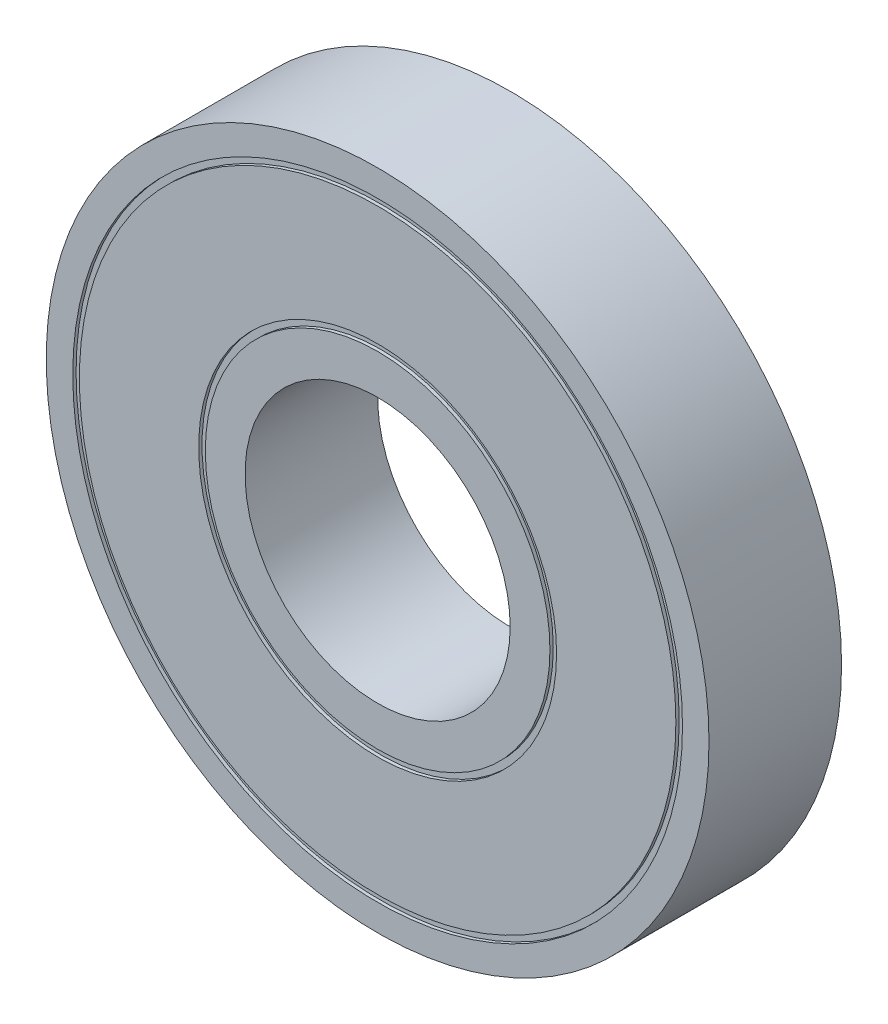
from build123d import *

# Parameters (mm, degrees)
ESBO_O1_R                = 25
ESBO_O1_R_2              = 10
RESSALTO_EXTRUS_O1_DEPTH = 5
ESBO_O2_R                = 23
ESBO_O2_R_2              = 22.5
ESBO_O2_R_3              = 13.5
ESBO_O2_R_4              = 13
CORTE_EXTRUS_O1_DEPTH    = 0.25


with BuildPart() as part:
    # Esboço1 → Ressalto-extrusão1 (new, symmetric)
    with BuildSketch(Plane.XY):
        Circle(ESBO_O1_R)
        Circle(ESBO_O1_R_2, mode=Mode.SUBTRACT)
    extrude(amount=RESSALTO_EXTRUS_O1_DEPTH, both=True)

    # Esboço2 → Corte-extrusão1 (cut)
    # profile 1 of 2: a face of its own
    with BuildSketch(Plane.XY.offset(5)):
        Circle(ESBO_O2_R)
        Circle(ESBO_O2_R_2, mode=Mode.SUBTRACT)
    # profile 2 of 2: a face of its own
    with BuildSketch(Plane.XY.offset(5)):
        Circle(ESBO_O2_R_3)
        Circle(ESBO_O2_R_4, mode=Mode.SUBTRACT)
    corte_extrus_o1 = extrude(amount=-CORTE_EXTRUS_O1_DEPTH, mode=Mode.SUBTRACT)

    # Espelhar1: Corte-extrusão1 across plane
    add(corte_extrus_o1.mirror(Plane.XY), mode=Mode.SUBTRACT)


solid = part.part
